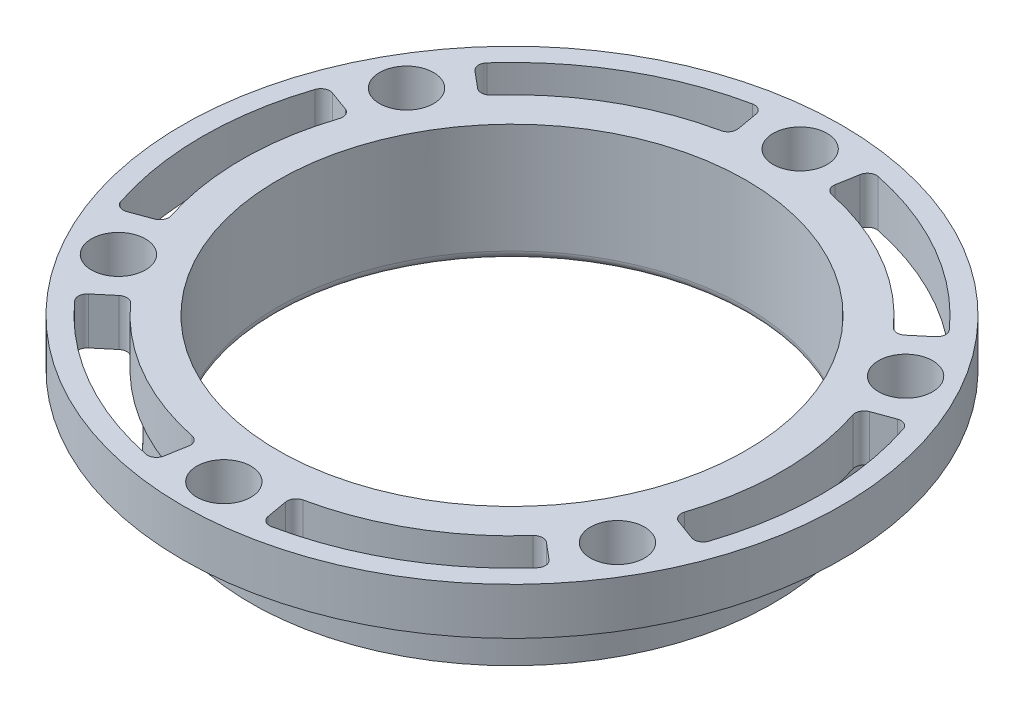
from build123d import *

# Parameters (mm, degrees)
SKETCH_2_R               = 7.5
CUT_EXTRUDE_1_DEPTH      = 134.542128184
CUT_EXTRUDE_2_DEPTH      = 134.542128184
PATTERN_CIRCULAR_1_COUNT = 6
FILLET_1_R               = 2.5
SKETCH_4_R               = 100
SKETCH_4_R_2             = 72.5
CUT_EXTRUDE_3_DEPTH      = 20


with BuildPart() as part:
    # 草图1 → 旋转1 (revolve)
    with BuildSketch(Plane(origin=(0, 0, 0), x_dir=(0, 0, -1), z_dir=(1, 0, 0)), mode=Mode.PRIVATE) as revolve_1_sk:
        Polygon((-91.5, 33), (-91.5, 0), (-65, 0), (-65, 3), (-65, 33), (-69, 33), align=None)
    revolve(revolve_1_sk.sketch.rotate(Axis((0, 0, 0), (0, 1, 0)), 180), axis=Axis((0, 0, 0), (0, 1, 0)))

    # 草图2 → 切除-拉伸1 (cut, through all)
    with BuildSketch(Plane(origin=(0, 33, 0), x_dir=(1, 0, 0), z_dir=(0, 1, 0))):
        with Locations(Location((0, 80, 0), (0, 0, 270))):
            Circle(SKETCH_2_R)
    cut_extrude_1 = extrude(amount=-CUT_EXTRUDE_1_DEPTH, mode=Mode.SUBTRACT)

    # 草图3 → 切除-拉伸2 (cut, through all)
    with BuildSketch(Plane(origin=(0, 33, 0), x_dir=(1, 0, 0), z_dir=(0, 1, 0))):
        with BuildLine():
            Line((-72.788277417, 26.492766383), (-78.429157814, 28.545878943))
            ThreePointArc((-78.429157814, 28.545878943), (-80.374557913, 28.44634458), (-81.65798686, 26.980978151))
            ThreePointArc((-81.65798686, 26.980978151), (-86, 0), (-81.65798686, -26.980978151))
            ThreePointArc((-81.65798686, -26.980978151), (-80.374557913, -28.44634458), (-78.429157814, -28.545878943))
            Line((-78.429157814, -28.545878943), (-72.788277417, -26.492766383))
            ThreePointArc((-72.788277417, -26.492766383), (-71.394896395, -25.236492438), (-71.267736557, -23.364711127))
            ThreePointArc((-71.267736557, -23.364711127), (-75, 0), (-71.267736557, 23.364711127))
            ThreePointArc((-71.267736557, 23.364711127), (-71.394896395, 25.236492438), (-72.788277417, 26.492766383))
        make_face()
    cut_extrude_2 = extrude(amount=-CUT_EXTRUDE_2_DEPTH, mode=Mode.SUBTRACT)

    # 阵列(圆周)1: 切除-拉伸1, 切除-拉伸2 ×6 about axis
    pattern_circular_1_axis = Axis((0, 0, 0), (0, 1, 0))
    add([cut_extrude_1.rotate(pattern_circular_1_axis, i * 360 / PATTERN_CIRCULAR_1_COUNT) for i in range(1, PATTERN_CIRCULAR_1_COUNT)], mode=Mode.SUBTRACT)
    add([cut_extrude_2.rotate(pattern_circular_1_axis, i * 360 / PATTERN_CIRCULAR_1_COUNT) for i in range(1, PATTERN_CIRCULAR_1_COUNT)], mode=Mode.SUBTRACT)

    # 圆角1
    fillet_1_edges = [part.edges().sort_by_distance(p)[0] for p in [
        (0, 0, 65),
        (0, 0, 91.5),
    ]]
    fillet(fillet_1_edges, radius=FILLET_1_R)

    # 草图4 → 切除-拉伸3 (cut)
    with BuildSketch(Plane.XZ):
        Circle(SKETCH_4_R)
        with Locations(Location((0, 0, 0), (0, 0, 270))):
            Circle(SKETCH_4_R_2, mode=Mode.SUBTRACT)
    extrude(amount=-CUT_EXTRUDE_3_DEPTH, mode=Mode.SUBTRACT)


solid = part.part
